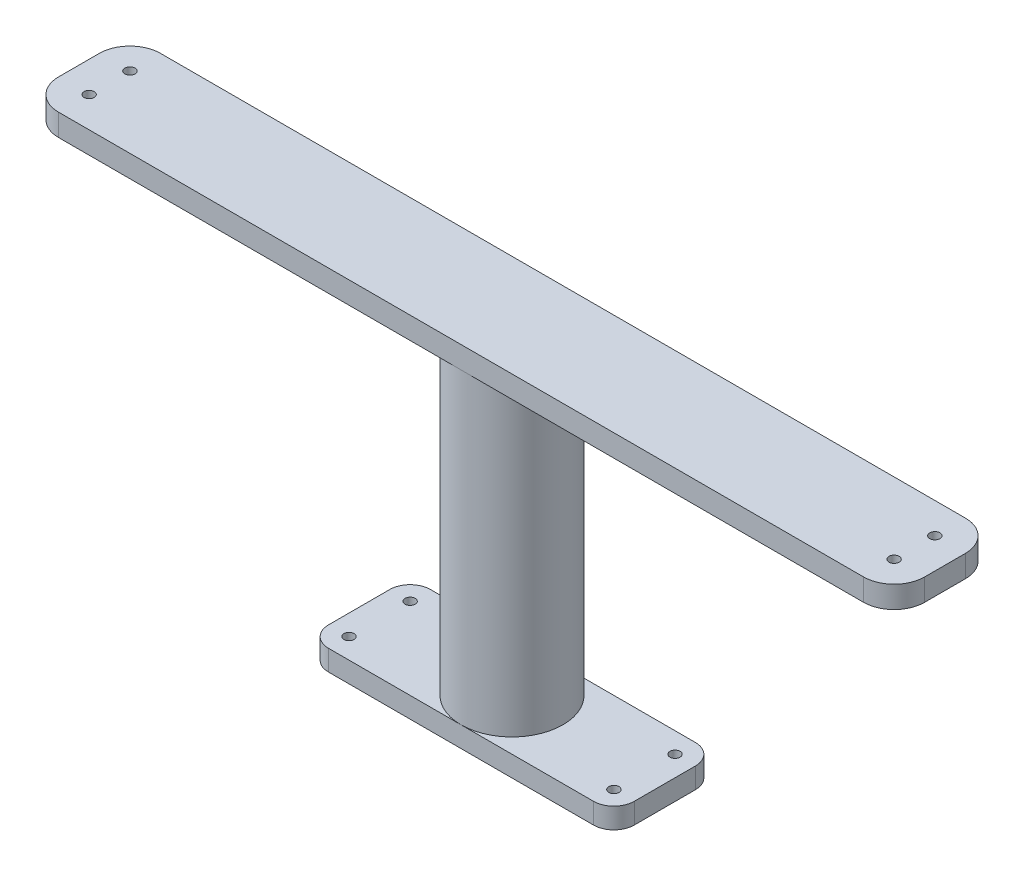
from build123d import *

# Parameters (mm, degrees)
SKETCH1_R           = 5
BOSS_EXTRUDE1_DEPTH = 1.5875
SKETCH2_R           = 50
SKETCH2_R_2         = 45
BOSS_EXTRUDE2_DEPTH = 341.625
SKETCH3_R           = 5
BOSS_EXTRUDE3_DEPTH = 0.218965517
BOSS_EXTRUDE4_START = 20
SKETCH4_R           = 5
BOSS_EXTRUDE4_DEPTH = 20
BOSS_EXTRUDE5_START = 20
SKETCH5_R           = 5
BOSS_EXTRUDE5_DEPTH = 20


with BuildPart() as part:
    # Sketch1 → Boss-Extrude1 (new body)
    with BuildSketch(Plane(origin=(0, 0, 0), x_dir=(1, 0, 0), z_dir=(0, 1, 0))):
        with BuildLine():
            Line((-395, 50), (395, 50))
            ThreePointArc((395, 50), (416.213203436, 41.213203436), (425, 20))
            Line((425, 20), (425, -20))
            ThreePointArc((425, -20), (416.213203436, -41.213203436), (395, -50))
            Line((395, -50), (-395, -50))
            ThreePointArc((-395, -50), (-416.213203436, -41.213203436), (-425, -20))
            Line((-425, -20), (-425, 20))
            ThreePointArc((-425, 20), (-416.213203436, 41.213203436), (-395, 50))
        make_face()
        with Locations((-395, 20)):
            Circle(SKETCH1_R, mode=Mode.SUBTRACT)
        with Locations((-395, -20)):
            Circle(SKETCH1_R, mode=Mode.SUBTRACT)
        with Locations((395, 20)):
            Circle(SKETCH1_R, mode=Mode.SUBTRACT)
        with Locations((395, -20)):
            Circle(SKETCH1_R, mode=Mode.SUBTRACT)
    extrude(amount=BOSS_EXTRUDE1_DEPTH)

    # Sketch2 → Boss-Extrude2 (add)
    with BuildSketch(Plane.XZ):
        Circle(SKETCH2_R)
        Circle(SKETCH2_R_2, mode=Mode.SUBTRACT)
    extrude(amount=BOSS_EXTRUDE2_DEPTH)

    # Sketch3 → Boss-Extrude3 (add)
    with BuildSketch(Plane.XZ.offset(341.625)):
        with BuildLine():
            Line((-130, 50), (130, 50))
            ThreePointArc((130, 50), (144.142135624, 44.142135624), (150, 30))
            Line((150, 30), (150, -30))
            ThreePointArc((150, -30), (144.142135624, -44.142135624), (130, -50))
            Line((130, -50), (-130, -50))
            ThreePointArc((-130, -50), (-144.142135624, -44.142135624), (-150, -30))
            Line((-150, -30), (-150, 30))
            ThreePointArc((-150, 30), (-144.142135624, 44.142135624), (-130, 50))
        make_face()
        with Locations((-130, 30)):
            Circle(SKETCH3_R, mode=Mode.SUBTRACT)
        with Locations((-130, -30)):
            Circle(SKETCH3_R, mode=Mode.SUBTRACT)
        with Locations((130, 30)):
            Circle(SKETCH3_R, mode=Mode.SUBTRACT)
        with Locations((130, -30)):
            Circle(SKETCH3_R, mode=Mode.SUBTRACT)
    extrude(amount=BOSS_EXTRUDE3_DEPTH)

    # Sketch4 → Boss-Extrude4 (add)
    # profile 1 of 2: a face of its own
    with BuildSketch(Plane.XZ.offset(BOSS_EXTRUDE4_START)):
        with BuildLine():
            ThreePointArc((0, 50), (50, 0), (0, -50))
            Line((0, -50), (395, -50))
            ThreePointArc((395, -50), (416.213203436, -41.213203436), (425, -20))
            Line((425, -20), (425, 20))
            ThreePointArc((425, 20), (416.213203436, 41.213203436), (395, 50))
            Line((395, 50), (0, 50))
        make_face()
        with Locations((395, -20)):
            Circle(SKETCH4_R, mode=Mode.SUBTRACT)
        with Locations((395, 20)):
            Circle(SKETCH4_R, mode=Mode.SUBTRACT)
    # profile 2 of 2: a face of its own
    with BuildSketch(Plane.XZ.offset(BOSS_EXTRUDE4_START)):
        with BuildLine():
            Line((-395, -50), (0, -50))
            ThreePointArc((0, -50), (-50, 0), (0, 50))
            Line((0, 50), (-395, 50))
            ThreePointArc((-395, 50), (-416.213203436, 41.213203436), (-425, 20))
            Line((-425, 20), (-425, -20))
            ThreePointArc((-425, -20), (-416.213203436, -41.213203436), (-395, -50))
        make_face()
        with Locations((-395, -20)):
            Circle(SKETCH4_R, mode=Mode.SUBTRACT)
        with Locations((-395, 20)):
            Circle(SKETCH4_R, mode=Mode.SUBTRACT)
    extrude(amount=-BOSS_EXTRUDE4_DEPTH)

    # Sketch5 → Boss-Extrude5 (add)
    # profile 1 of 2: a face of its own
    with BuildSketch(Plane(origin=(0, -341.625, 0), x_dir=(1, 0, 0), z_dir=(0, 1, 0)).offset(BOSS_EXTRUDE5_START)):
        with BuildLine():
            ThreePointArc((150, 30), (144.142135624, 44.142135624), (130, 50))
            Line((130, 50), (0, 50))
            ThreePointArc((0, 50), (50, 0), (0, -50))
            Line((0, -50), (130, -50))
            ThreePointArc((130, -50), (144.142135624, -44.142135624), (150, -30))
            Line((150, -30), (150, 30))
        make_face()
        with Locations((130, -30)):
            Circle(SKETCH5_R, mode=Mode.SUBTRACT)
        with Locations((130, 30)):
            Circle(SKETCH5_R, mode=Mode.SUBTRACT)
    # profile 2 of 2: a face of its own
    with BuildSketch(Plane(origin=(0, -341.625, 0), x_dir=(1, 0, 0), z_dir=(0, 1, 0)).offset(BOSS_EXTRUDE5_START)):
        with BuildLine():
            ThreePointArc((0, -50), (-50, 0), (0, 50))
            Line((0, 50), (-130, 50))
            ThreePointArc((-130, 50), (-144.142135624, 44.142135624), (-150, 30))
            Line((-150, 30), (-150, -30))
            ThreePointArc((-150, -30), (-144.142135624, -44.142135624), (-130, -50))
            Line((-130, -50), (0, -50))
        make_face()
        with Locations((-130, -30)):
            Circle(SKETCH5_R, mode=Mode.SUBTRACT)
        with Locations((-130, 30)):
            Circle(SKETCH5_R, mode=Mode.SUBTRACT)
    extrude(amount=-BOSS_EXTRUDE5_DEPTH)


solid = part.part
